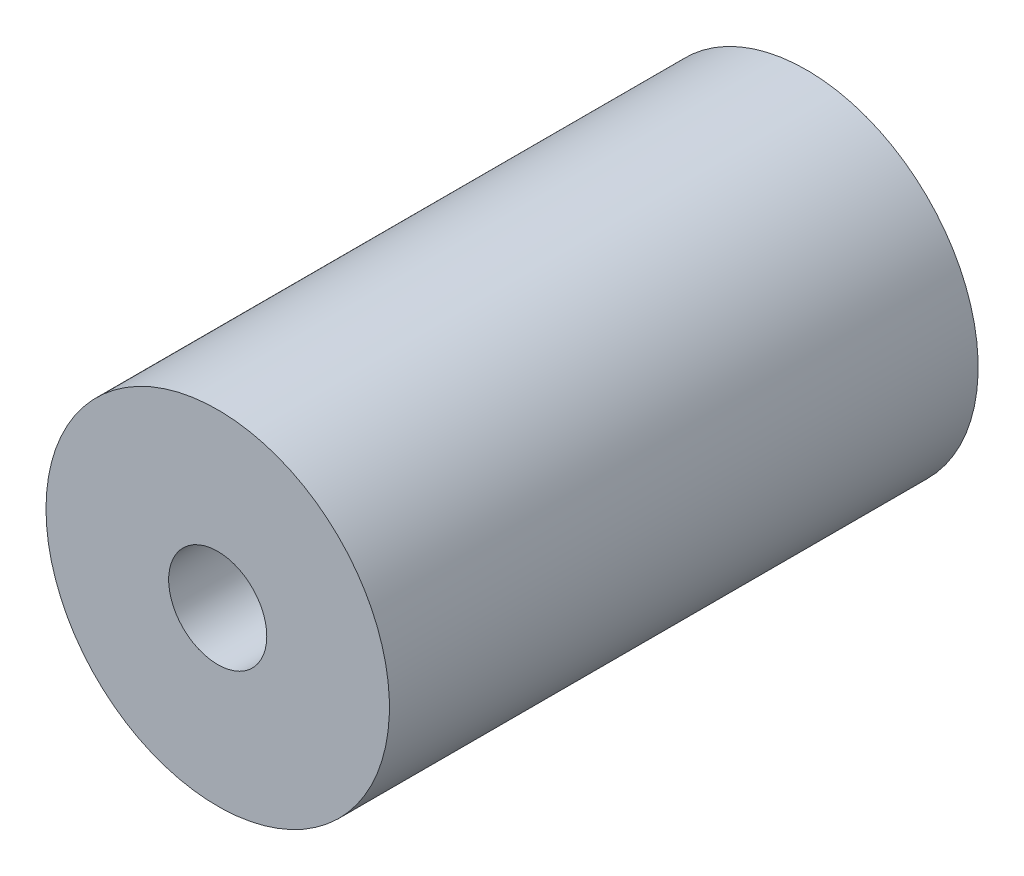
from build123d import *

# Parameters (mm, degrees)
SKETCH1_R           = 4.445
BOSS_EXTRUDE1_DEPTH = 15.24
SKETCH2_R           = 1.27
CUT_EXTRUDE1_DEPTH  = 2.54


with BuildPart() as part:
    # Sketch1 → Boss-Extrude1 (new body)
    with BuildSketch(Plane.XY):
        with Locations(Location((0, 0, 0), (0, 0, 180))):
            Circle(SKETCH1_R)
    extrude(amount=BOSS_EXTRUDE1_DEPTH)

    # Sketch2 → Cut-Extrude1 (cut)
    with BuildSketch(Plane.XY.offset(15.24)):
        Circle(SKETCH2_R)
    extrude(amount=-CUT_EXTRUDE1_DEPTH, mode=Mode.SUBTRACT)


solid = part.part
